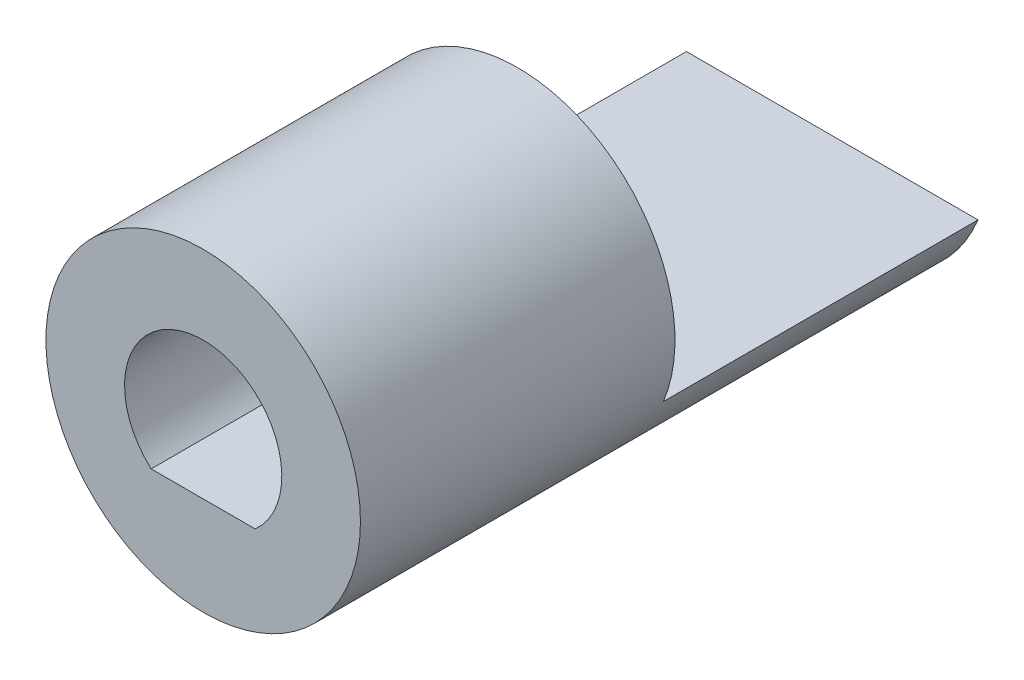
from build123d import *

# Parameters (mm, degrees)
SKETCH1_R           = 12.7
BOSS_EXTRUDE1_DEPTH = 25.4
BOSS_EXTRUDE2_START = -25.4
BOSS_EXTRUDE2_DEPTH = 25.4


with BuildPart() as part:
    # Sketch1 → Boss-Extrude1 (new body)
    with BuildSketch(Plane.XY):
        Circle(SKETCH1_R)
        with BuildLine():
            Line((4.200130206, -4.7625), (-4.200130206, -4.7625))
            ThreePointArc((-4.200130206, -4.7625), (0, 6.35), (4.200130206, -4.7625))
        make_face(mode=Mode.SUBTRACT)
    extrude(amount=BOSS_EXTRUDE1_DEPTH)

    # Sketch1<4> → Boss-Extrude2 (add)
    with BuildSketch(Plane.XY.offset(BOSS_EXTRUDE2_START)):
        with BuildLine():
            Line((4.200130206, -4.7625), (-4.200130206, -4.7625))
            Line((-4.200130206, -4.7625), (-11.773215098, -4.7625))
            ThreePointArc((-11.773215098, -4.7625), (0, -12.7), (11.773215098, -4.7625))
            Line((11.773215098, -4.7625), (4.200130206, -4.7625))
        make_face()
    extrude(amount=BOSS_EXTRUDE2_DEPTH)


solid = part.part
